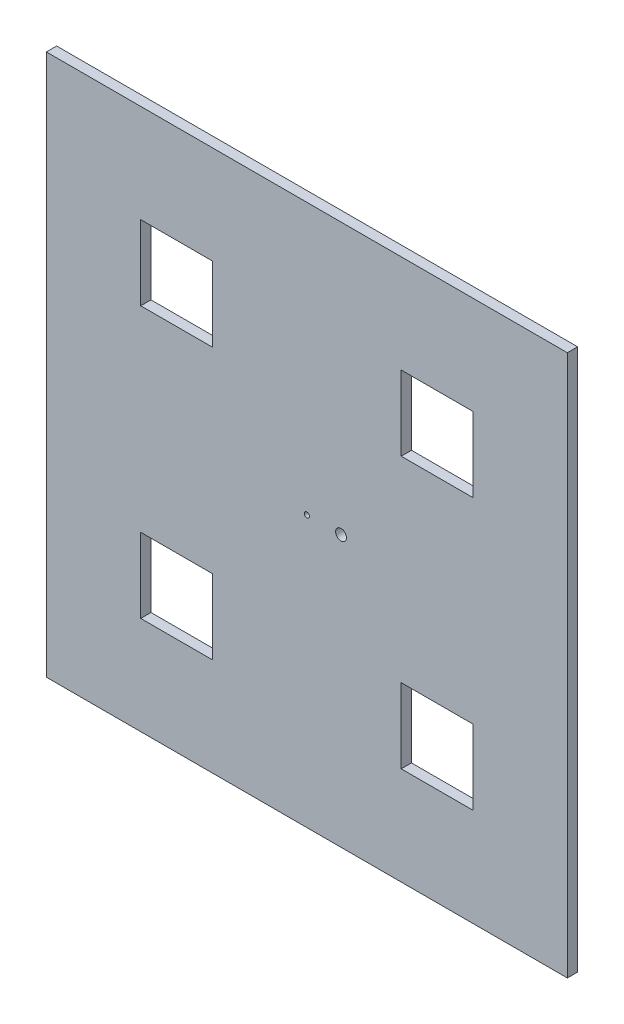
from build123d import *

# Parameters (mm, degrees)
SKETCH1_W           = 304.8
SKETCH1_H           = 316.8
BOSS_EXTRUDE1_DEPTH = 6
SKETCH3_W           = 42
SKETCH3_H           = 43.653543308
CUT_EXTRUDE2_DEPTH  = 220.891609663
SKETCH4_R           = 1.5
CUT_EXTRUDE3_DEPTH  = 220.891609663
SKETCH5_R           = 3.175
CUT_EXTRUDE4_DEPTH  = 220.891609663


with BuildPart() as part:
    # Sketch1 → Boss-Extrude1 (new body)
    with BuildSketch(Plane.XY):
        Rectangle(SKETCH1_W, SKETCH1_H)
    extrude(amount=BOSS_EXTRUDE1_DEPTH)

    # Sketch3 → Cut-Extrude2 (cut, through all)
    with BuildSketch(Plane.XY.offset(6)):
        with Locations((-76.2, 79.2)):
            Rectangle(SKETCH3_W, SKETCH3_H)
        with Locations((76.2, 79.2)):
            Rectangle(SKETCH3_W, SKETCH3_H)
        with Locations((76.2, -79.2)):
            Rectangle(SKETCH3_W, SKETCH3_H)
        with Locations((-76.2, -79.2)):
            Rectangle(SKETCH3_W, SKETCH3_H)
    extrude(amount=-CUT_EXTRUDE2_DEPTH, mode=Mode.SUBTRACT)

    # Sketch4 → Cut-Extrude3 (cut, through all)
    with BuildSketch(Plane.XY.offset(6)):
        Circle(SKETCH4_R)
    extrude(amount=-CUT_EXTRUDE3_DEPTH, mode=Mode.SUBTRACT)

    # Sketch5 → Cut-Extrude4 (cut, through all)
    with BuildSketch(Plane.XY.offset(6)):
        with Locations((20, 0)):
            Circle(SKETCH5_R)
    extrude(amount=-CUT_EXTRUDE4_DEPTH, mode=Mode.SUBTRACT)


solid = part.part
